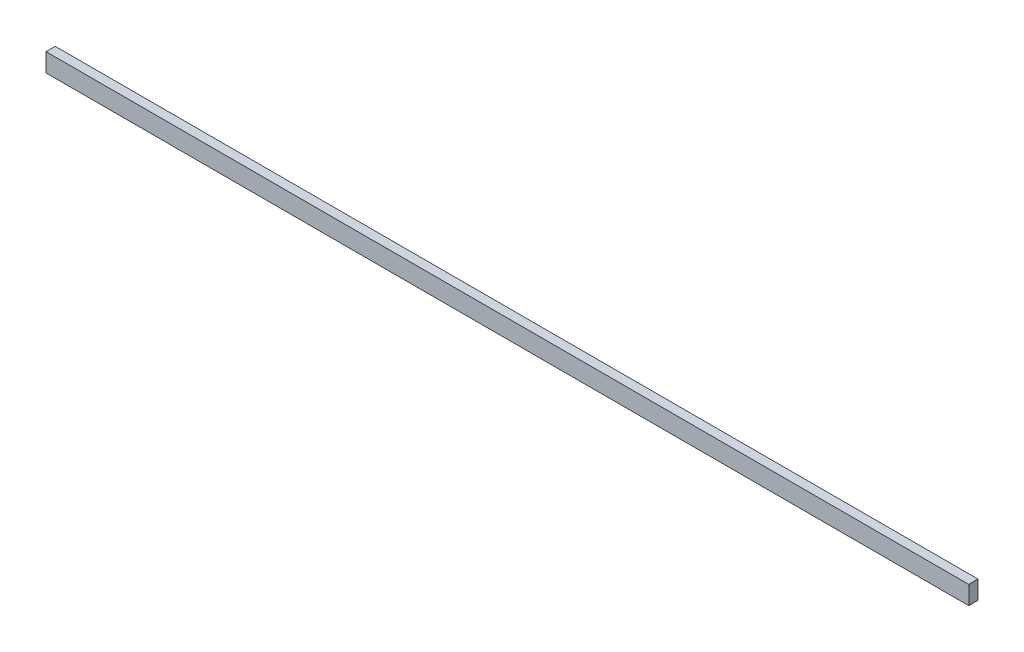
from build123d import *

# Parameters (mm, degrees)
SKETCH1_W      = 2540
SKETCH1_H      = 50.8
EXTRUDE1_DEPTH = 25.4


with BuildPart() as part:
    # Sketch1 → Extrude1 (new body)
    with BuildSketch(Plane.XY):
        with Locations((1270, 0)):
            Rectangle(SKETCH1_W, SKETCH1_H)
    extrude(amount=EXTRUDE1_DEPTH)


solid = part.part
